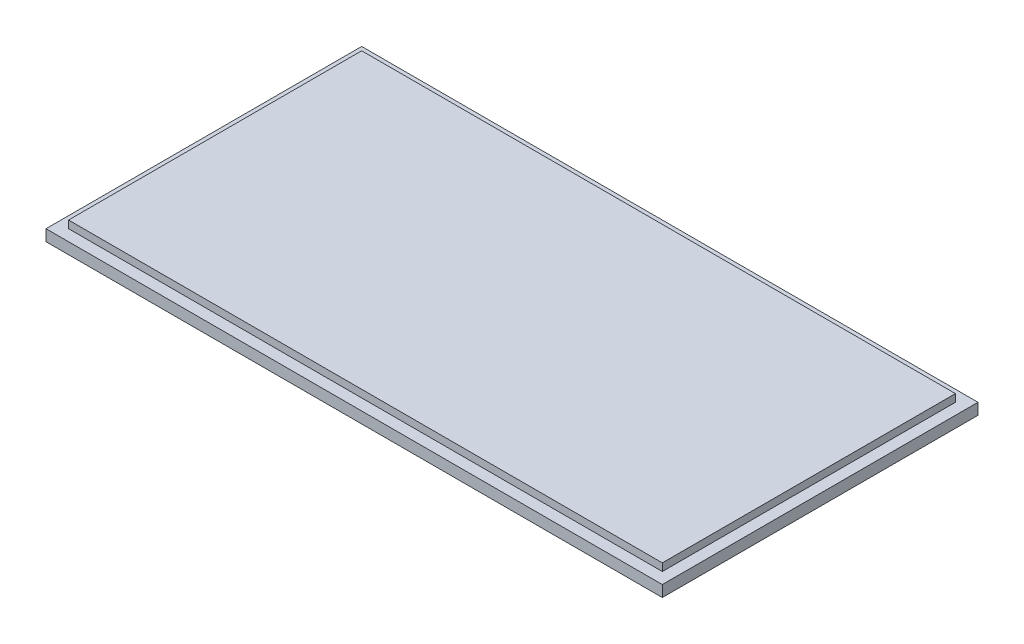
from build123d import *

# Parameters (mm, degrees)
SKETCH1_W           = 164
SKETCH1_H           = 84
BOSS_EXTRUDE1_DEPTH = 3
SKETCH2_W           = 158
SKETCH2_H           = 78
BOSS_EXTRUDE2_DEPTH = 2


with BuildPart() as part:
    # Sketch1 → Boss-Extrude1 (new body)
    with BuildSketch(Plane(origin=(0, 0, 0), x_dir=(1, 0, 0), z_dir=(0, 1, 0))):
        with Locations((82, 42)):
            Rectangle(SKETCH1_W, SKETCH1_H)
    extrude(amount=BOSS_EXTRUDE1_DEPTH)

    # Sketch2 → Boss-Extrude2 (add)
    with BuildSketch(Plane(origin=(0, 3, 0), x_dir=(1, 0, 0), z_dir=(0, 1, 0))):
        with Locations((82, 42)):
            Rectangle(SKETCH2_W, SKETCH2_H)
    extrude(amount=BOSS_EXTRUDE2_DEPTH)


solid = part.part
